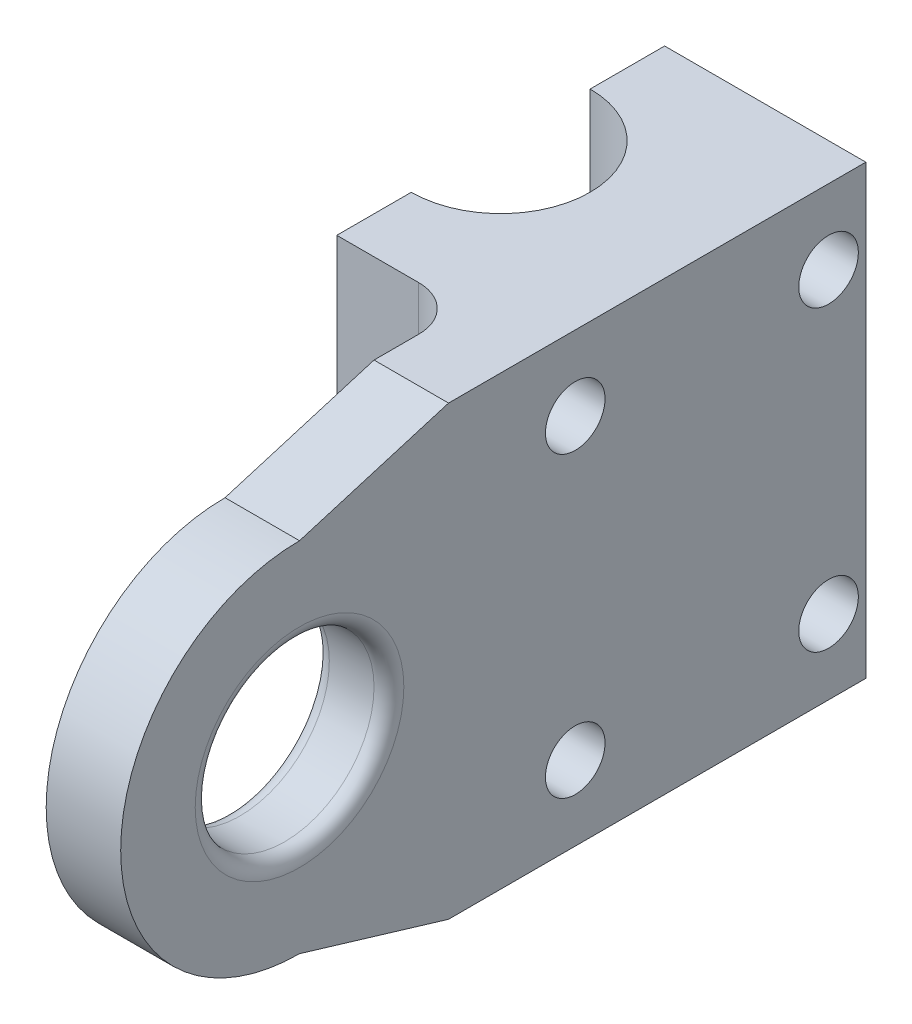
from build123d import *

# Parameters (mm, degrees)
BOSS_EXTRUDE1_DEPTH = 30
CUT_EXTRUDE2_REACH  = 61.852
SKETCH3_R           = 2
SKETCH3_R_2         = 6
FILLET1_R           = 1


with BuildPart() as part:
    # Sketch2 → Boss-Extrude1 (new body)
    with BuildSketch(Plane(origin=(0, 0, 0), x_dir=(1, 0, 0), z_dir=(0, 1, 0))):
        with BuildLine():
            Line((0, 50), (13.5, 50))
            Line((13.5, 50), (13.5, 0))
            Line((13.5, 0), (8.5, 0))
            Line((8.5, 0), (8.5, 25))
            ThreePointArc((8.5, 25), (7.621320344, 27.121320344), (5.5, 28))
            Line((5.5, 28), (0, 28))
            Line((0, 28), (0, 33))
            ThreePointArc((0, 33), (6, 39), (0, 45))
            Line((0, 45), (0, 50))
        make_face()
    extrude(amount=BOSS_EXTRUDE1_DEPTH)

    # Sketch3 → Cut-Extrude2 (cut, up to next)
    with BuildSketch(Plane(origin=(13.5, 0, 0), x_dir=(0, 0, -1), z_dir=(1, 0, 0)), mode=Mode.PRIVATE) as cut_extrude2_sk1:
        with BuildLine():
            ThreePointArc((0, 15), (3.514718626, 23.485281374), (12, 27))
            Line((12, 27), (22, 30))
            Line((22, 30), (0, 30))
            Line((0, 30), (0, 15))
        make_face()
    cut_extrude2_tool1 = extrude(cut_extrude2_sk1.sketch, amount=-CUT_EXTRUDE2_REACH, mode=Mode.PRIVATE) & part.part
    # Sketch3 → Cut-Extrude2 (cut, up to next)
    with BuildSketch(Plane(origin=(13.5, 0, 0), x_dir=(0, 0, -1), z_dir=(1, 0, 0)), mode=Mode.PRIVATE) as cut_extrude2_sk2:
        with BuildLine():
            ThreePointArc((12, 3), (3.514718626, 6.514718626), (0, 15))
            Line((0, 15), (0, 0))
            Line((0, 0), (22, 0))
            Line((22, 0), (12, 3))
        make_face()
    cut_extrude2_tool2 = extrude(cut_extrude2_sk2.sketch, amount=-CUT_EXTRUDE2_REACH, mode=Mode.PRIVATE) & part.part
    # Sketch3 → Cut-Extrude2 (cut, up to next)
    with BuildSketch(Plane(origin=(13.5, 0, 0), x_dir=(0, 0, -1), z_dir=(1, 0, 0)), mode=Mode.PRIVATE) as cut_extrude2_sk3:
        with Locations((30.5, 5)):
            Circle(SKETCH3_R)
    cut_extrude2_tool3 = extrude(cut_extrude2_sk3.sketch, amount=-CUT_EXTRUDE2_REACH, mode=Mode.PRIVATE) & part.part
    # Sketch3 → Cut-Extrude2 (cut, up to next)
    with BuildSketch(Plane(origin=(13.5, 0, 0), x_dir=(0, 0, -1), z_dir=(1, 0, 0)), mode=Mode.PRIVATE) as cut_extrude2_sk4:
        with Locations((47.5, 5)):
            Circle(SKETCH3_R)
    cut_extrude2_tool4 = extrude(cut_extrude2_sk4.sketch, amount=-CUT_EXTRUDE2_REACH, mode=Mode.PRIVATE) & part.part
    # Sketch3 → Cut-Extrude2 (cut, up to next)
    with BuildSketch(Plane(origin=(13.5, 0, 0), x_dir=(0, 0, -1), z_dir=(1, 0, 0)), mode=Mode.PRIVATE) as cut_extrude2_sk5:
        with Locations((47.5, 5)):
            Circle(SKETCH3_R)
    cut_extrude2_tool5 = extrude(cut_extrude2_sk5.sketch, amount=-CUT_EXTRUDE2_REACH, mode=Mode.PRIVATE) & part.part
    # Sketch3 → Cut-Extrude2 (cut, up to next)
    with BuildSketch(Plane(origin=(13.5, 0, 0), x_dir=(0, 0, -1), z_dir=(1, 0, 0)), mode=Mode.PRIVATE) as cut_extrude2_sk6:
        with Locations((12, 15)):
            Circle(SKETCH3_R_2)
    cut_extrude2_tool6 = extrude(cut_extrude2_sk6.sketch, amount=-CUT_EXTRUDE2_REACH, mode=Mode.PRIVATE) & part.part
    # Sketch3 → Cut-Extrude2 (cut, up to next)
    with BuildSketch(Plane(origin=(13.5, 0, 0), x_dir=(0, 0, -1), z_dir=(1, 0, 0)), mode=Mode.PRIVATE) as cut_extrude2_sk7:
        with Locations((30.5, 25)):
            Circle(SKETCH3_R)
    cut_extrude2_tool7 = extrude(cut_extrude2_sk7.sketch, amount=-CUT_EXTRUDE2_REACH, mode=Mode.PRIVATE) & part.part
    # Sketch3 → Cut-Extrude2 (cut, up to next)
    with BuildSketch(Plane(origin=(13.5, 0, 0), x_dir=(0, 0, -1), z_dir=(1, 0, 0)), mode=Mode.PRIVATE) as cut_extrude2_sk8:
        with Locations((47.5, 25)):
            Circle(SKETCH3_R)
    cut_extrude2_tool8 = extrude(cut_extrude2_sk8.sketch, amount=-CUT_EXTRUDE2_REACH, mode=Mode.PRIVATE) & part.part
    add(cut_extrude2_tool1.solids().sort_by_distance((13.5, 27.014261, -6.456835))[0], mode=Mode.SUBTRACT)
    add(cut_extrude2_tool2.solids().sort_by_distance((13.5, 2.985739, -6.456835))[0], mode=Mode.SUBTRACT)
    add(cut_extrude2_tool3.solids().sort_by_distance((13.5, 5, -30.5))[0], mode=Mode.SUBTRACT)
    add(cut_extrude2_tool4.solids().sort_by_distance((13.5, 5, -47.5))[0], mode=Mode.SUBTRACT)
    add(cut_extrude2_tool5.solids().sort_by_distance((13.5, 5, -47.5))[0], mode=Mode.SUBTRACT)
    add(cut_extrude2_tool6.solids().sort_by_distance((13.5, 15, -12))[0], mode=Mode.SUBTRACT)
    add(cut_extrude2_tool7.solids().sort_by_distance((13.5, 25, -30.5))[0], mode=Mode.SUBTRACT)
    add(cut_extrude2_tool8.solids().sort_by_distance((13.5, 25, -47.5))[0], mode=Mode.SUBTRACT)

    # Fillet1
    fillet1_edges = [part.edges().sort_by_distance(p)[0] for p in [
        (13.5, 15, -6),
        (8.5, 15, -6),
    ]]
    fillet(fillet1_edges, radius=FILLET1_R)


solid = part.part
